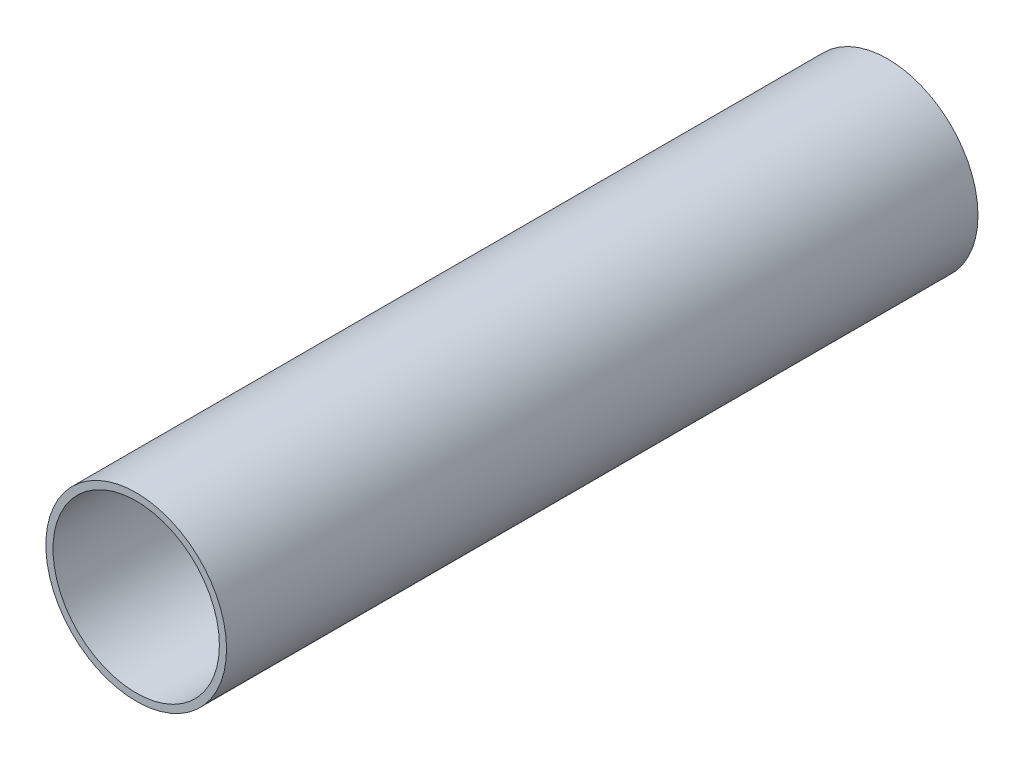
from build123d import *

# Parameters (mm, degrees)
SKETCH1_R               = 25.25
SKETCH1_R_2             = 23.25
BOSS_EXTRUDE1_DEPTH     = 210
CUT_EXTRUDE1_REACH      = 215.014
CUT_EXTRUDE1_END_RADIUS = 25.25
SKETCH3_W               = 28
SKETCH3_H               = 122


with BuildPart() as part:
    # Sketch1 → Boss-Extrude1 (new body)
    with BuildSketch(Plane.XY):
        Circle(SKETCH1_R)
        Circle(SKETCH1_R_2, mode=Mode.SUBTRACT)
    extrude(amount=BOSS_EXTRUDE1_DEPTH)

    # Cut-Extrude1: up to this cylinder (the profile starts inside it)
    cut_extrude1_end = Plane(origin=(0, 0, 97), z_dir=(0, 0, -1)) * Cylinder(CUT_EXTRUDE1_END_RADIUS, 481.528, mode=Mode.PRIVATE)
    # Sketch3 → Cut-Extrude1 (cut, up to the surface)
    with BuildSketch(Plane(origin=(0, 0, 0), x_dir=(1, 0, 0), z_dir=(0, 1, 0)), mode=Mode.PRIVATE) as cut_extrude1_sk1:
        with Locations((0, -97)):
            Rectangle(SKETCH3_W, SKETCH3_H)
    cut_extrude1_tool1 = extrude(cut_extrude1_sk1.sketch, amount=-CUT_EXTRUDE1_REACH, mode=Mode.PRIVATE) & cut_extrude1_end
    add(cut_extrude1_tool1.solids().sort_by_distance((0, 0, 97))[0], mode=Mode.SUBTRACT)


solid = part.part
